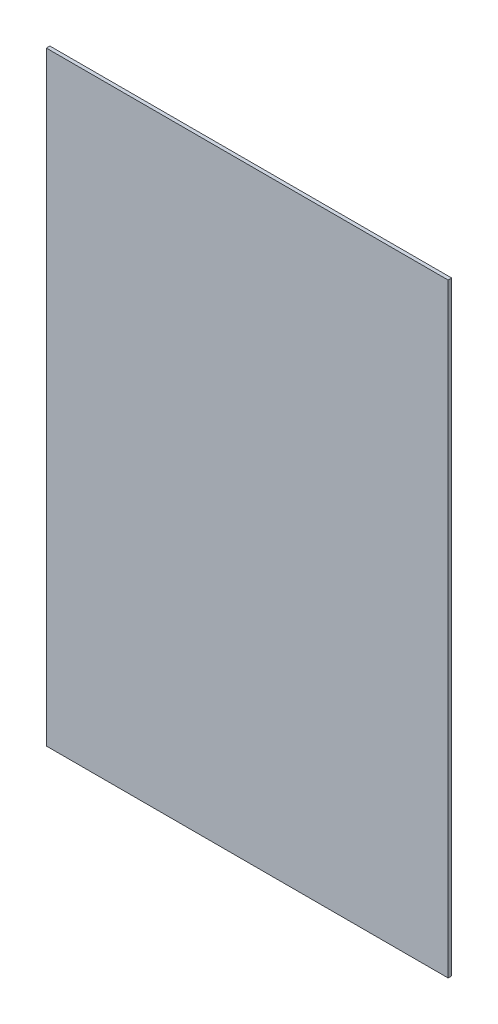
from build123d import *

# Parameters (mm, degrees)
SKETCH2_W           = 226
SKETCH2_H           = 340
BOSS_EXTRUDE1_DEPTH = 2


with BuildPart() as part:
    # Sketch2 → Boss-Extrude1 (new body)
    with BuildSketch(Plane.XY):
        Rectangle(SKETCH2_W, SKETCH2_H)
    extrude(amount=BOSS_EXTRUDE1_DEPTH)


solid = part.part
